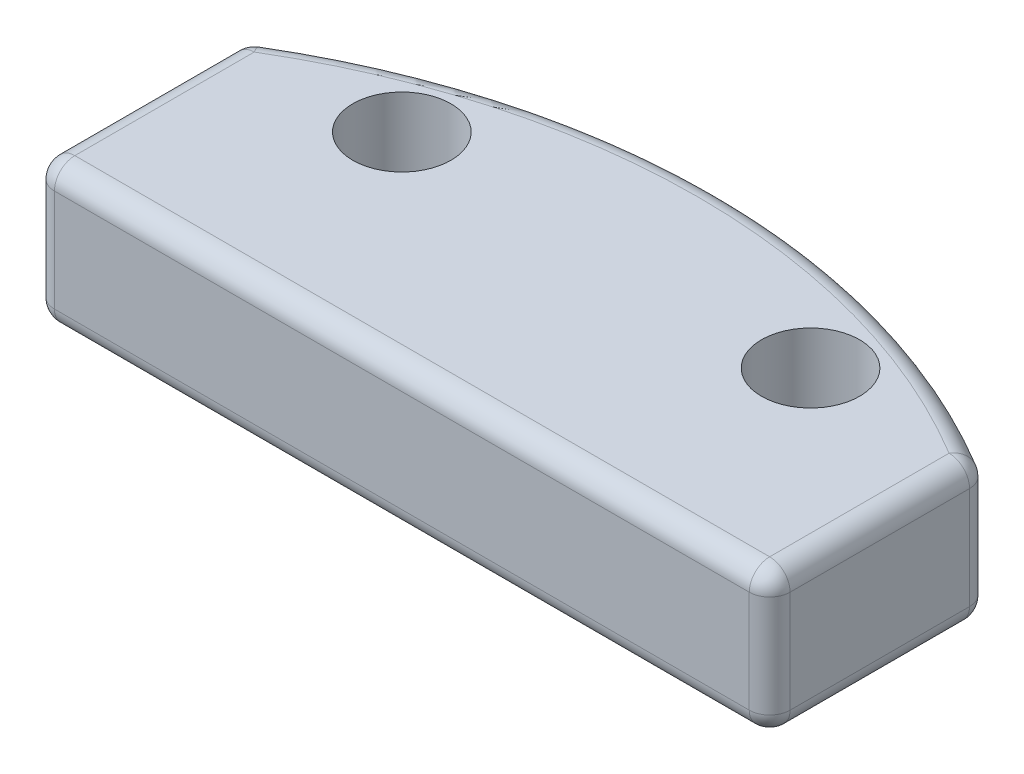
from build123d import *

# Parameters (mm, degrees)
SKETCH1_R           = 1.2
BOSS_EXTRUDE1_DEPTH = 3.5
FILLET1_R           = 0.5


with BuildPart() as part:
    # Sketch1 → Boss-Extrude1 (new body)
    with BuildSketch(Plane(origin=(0, 0, 0), x_dir=(1, 0, 0), z_dir=(0, 1, 0))):
        with BuildLine():
            Line((0, 0), (0, -5.17))
            Line((0, -5.17), (18, -5.17))
            Line((18, -5.17), (18, 0))
            ThreePointArc((18, 0), (9, 2.577794898), (0, 0))
        make_face()
        with Locations(Location((4, -0.17, 0), (0, 0, 270))):
            Circle(SKETCH1_R, mode=Mode.SUBTRACT)
        with Locations(Location((14, -0.17, 0), (0, 0, 270))):
            Circle(SKETCH1_R, mode=Mode.SUBTRACT)
    extrude(amount=BOSS_EXTRUDE1_DEPTH)

    # Fillet1
    fillet1_edges = [part.edges().sort_by_distance(p)[0] for p in [
        (0, 3.5, 2.585),
        (9, 3.5, 5.17),
        (18, 3.5, 2.585),
        (9, 0, 5.17),
        (0, 0, 2.585),
        (9, 0, -2.577794898),
        (18, 0, 2.585),
        (18, 1.75, 5.17),
        (0, 1.75, 5.17),
        (0, 1.75, 0),
        (18, 1.75, 0),
        (9, 3.5, -2.577794898),
    ]]
    fillet(fillet1_edges, radius=FILLET1_R)


solid = part.part
